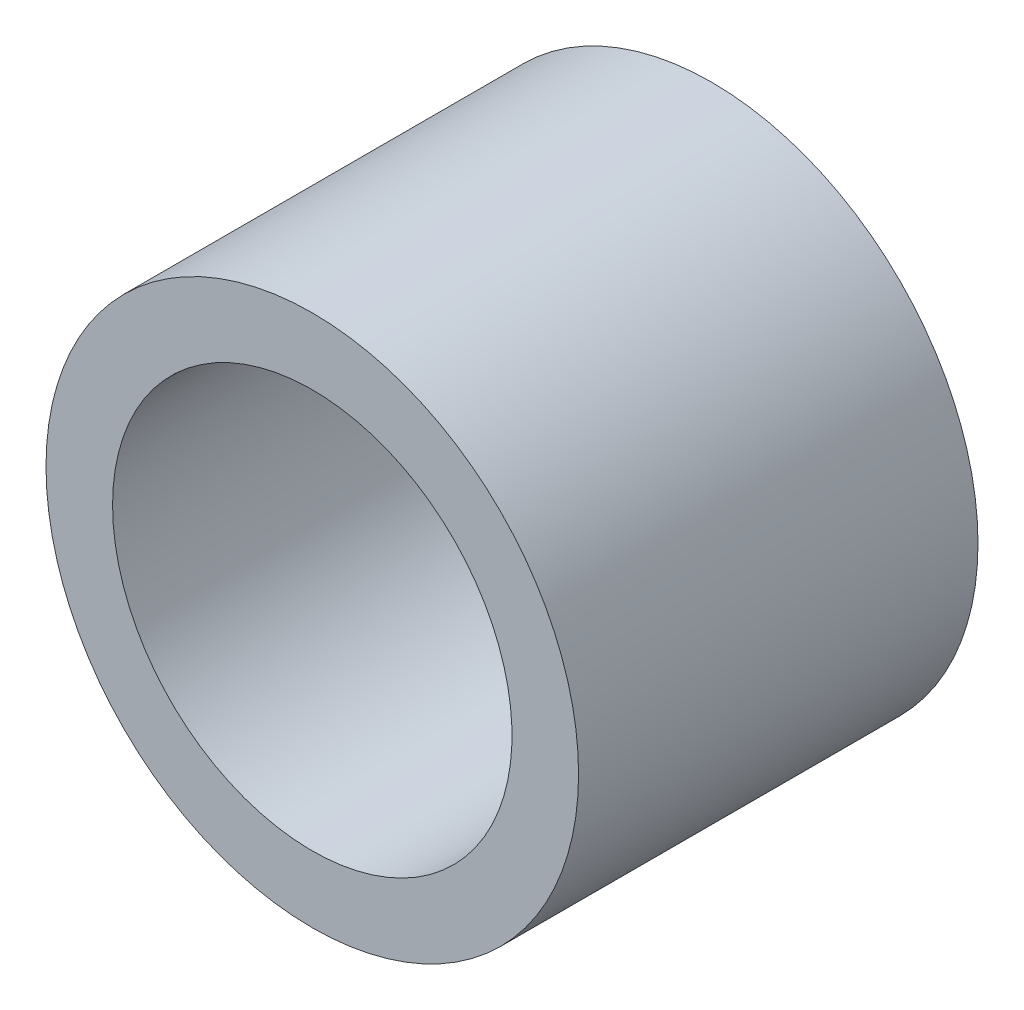
from build123d import *

# Parameters (mm, degrees)
SKETCH1_R           = 12.7
SKETCH1_R_2         = 9.525
BOSS_EXTRUDE1_DEPTH = 9.525


with BuildPart() as part:
    # Sketch1 → Boss-Extrude1 (new, symmetric)
    with BuildSketch(Plane.XY):
        with Locations(Location((0, 0, 0), (0, 0, 180))):
            Circle(SKETCH1_R)
        with Locations(Location((0, 0, 0), (0, 0, 180))):
            Circle(SKETCH1_R_2, mode=Mode.SUBTRACT)
    extrude(amount=BOSS_EXTRUDE1_DEPTH, both=True)


solid = part.part
